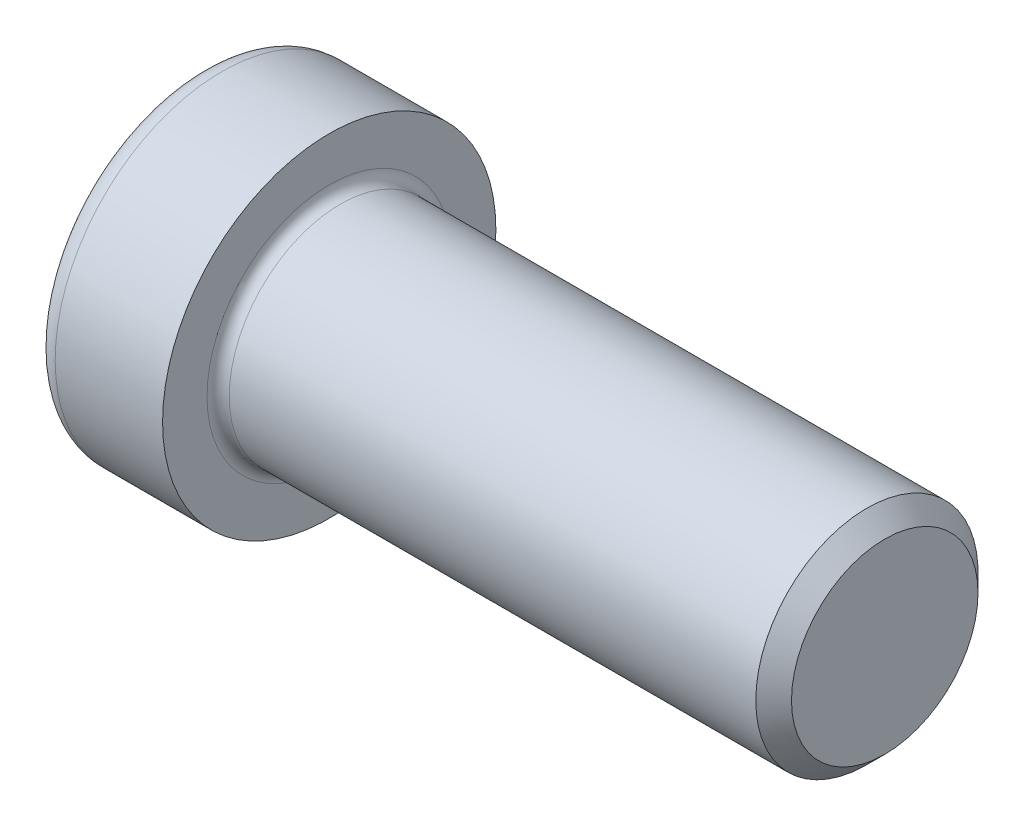
from build123d import *

# Parameters (mm, degrees)
FILLET1_R   = 0.6
FILLET2_R   = 1.2
HEX_2_DEPTH = 5


with BuildPart() as part:
    # BodySke → Base-Revolve (revolve)
    with BuildSketch(Plane.XY, mode=Mode.PRIVATE) as base_revolve_sk:
        Polygon((0, 0), (0, 9), (7, 9), (7, 6), (36.036, 6), (37, 5.036), (37, 0), align=None)
    revolve(base_revolve_sk.sketch.rotate(Axis((-31.75, 0, 0), (1, 0, 0)), 90), axis=Axis((-31.75, 0, 0), (1, 0, 0)))

    # Fillet1
    fillet1_edges = [part.edges().sort_by_distance(p)[0] for p in [
        (7, 0, -6),
    ]]
    fillet(fillet1_edges, radius=FILLET1_R)

    # Fillet2
    fillet2_edges = [part.edges().sort_by_distance(p)[0] for p in [
        (0, 0, -9),
    ]]
    fillet(fillet2_edges, radius=FILLET2_R)

    # Sketch2 → Hex-PreBroach (revolve, cut)
    with BuildSketch(Plane.XY, mode=Mode.PRIVATE) as hex_prebroach_sk:
        Polygon((0, 4), (5, 4), (7.309401077, 0), (0, 0), align=None)
    revolve(hex_prebroach_sk.sketch.rotate(Axis((0, 0, 0), (1, 0, 0)), 90), axis=Axis((0, 0, 0), (1, 0, 0)), mode=Mode.SUBTRACT)

    # Sketch3 → Hex 2 (cut)
    with BuildSketch(Plane(origin=(0, 0, 0), x_dir=(0, 0.500000000000001, 0.866025403784438), z_dir=(-1, 0, 0))):
        Polygon((2.309401077, 4), (-2.309401077, 4), (-4.618802154, 0), (-2.309401077, -4), (2.309401077, -4), (4.618802154, 0), align=None)
    extrude(amount=-HEX_2_DEPTH, mode=Mode.SUBTRACT)


solid = part.part
